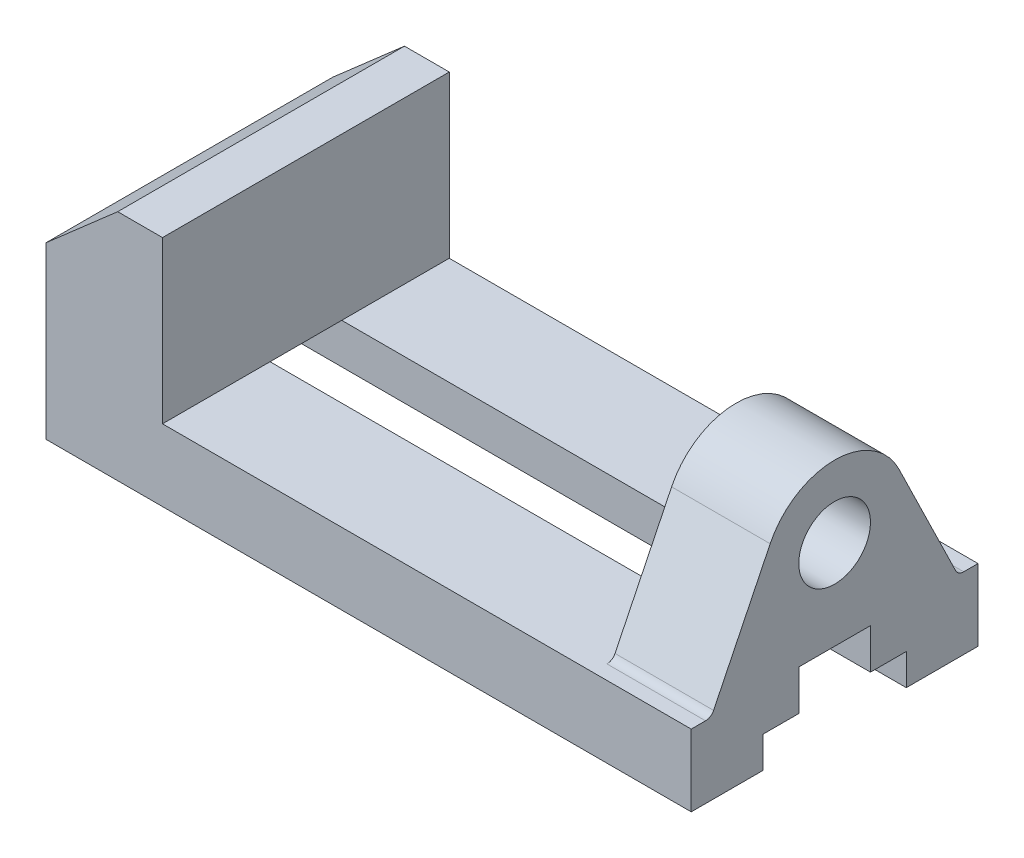
from build123d import *

# Parameters (mm, degrees)
SKETCH1_W           = 144
SKETCH1_H           = 64
BOSS_EXTRUDE1_DEPTH = 16
BOSS_EXTRUDE2_DEPTH = 64
SKETCH3_R           = 8
BOSS_EXTRUDE3_DEPTH = 22
FILLET1_R           = 2
CUT_EXTRUDE1_DEPTH  = 157.409718368


with BuildPart() as part:
    # Sketch1 → Boss-Extrude1 (new body)
    with BuildSketch(Plane(origin=(0, 0, 0), x_dir=(1, 0, 0), z_dir=(0, 1, 0))):
        Rectangle(SKETCH1_W, SKETCH1_H)
    extrude(amount=BOSS_EXTRUDE1_DEPTH)

    # Sketch2 → Boss-Extrude2 (add)
    with BuildSketch(Plane.XY.offset(32)):
        Polygon((-72, 16), (-72, 38), (-56, 52), (-46, 52), (-46, 16), align=None)
    extrude(amount=-BOSS_EXTRUDE2_DEPTH)

    # Sketch3 → Boss-Extrude3 (add)
    with BuildSketch(Plane(origin=(72, 0, 0), x_dir=(0, 0, -1), z_dir=(1, 0, 0))):
        with BuildLine():
            Line((-27.556282819, 16), (-14.380704741, 43.013938349))
            ThreePointArc((-14.380704741, 43.013938349), (0, 52), (14.380704741, 43.013938349))
            Line((14.380704741, 43.013938349), (27.556282819, 16))
            Line((27.556282819, 16), (-27.556282819, 16))
        make_face()
        with Locations((0, 36)):
            Circle(SKETCH3_R, mode=Mode.SUBTRACT)
    extrude(amount=-BOSS_EXTRUDE3_DEPTH)

    # Fillet1
    fillet1_edges = [part.edges().sort_by_distance(p)[0] for p in [
        (61, 16, -27.556282819),
        (61, 16, 27.556282819),
    ]]
    fillet(fillet1_edges, radius=FILLET1_R)

    # Sketch4 → Cut-Extrude1 (cut, through all)
    with BuildSketch(Plane(origin=(72, 0, 0), x_dir=(0, 0, -1), z_dir=(1, 0, 0))):
        Polygon((-16, 0), (-16, 7), (-8, 7), (-8, 16), (8, 16), (8, 7), (16, 7), (16, 0), align=None)
    extrude(amount=-CUT_EXTRUDE1_DEPTH, mode=Mode.SUBTRACT)


solid = part.part
